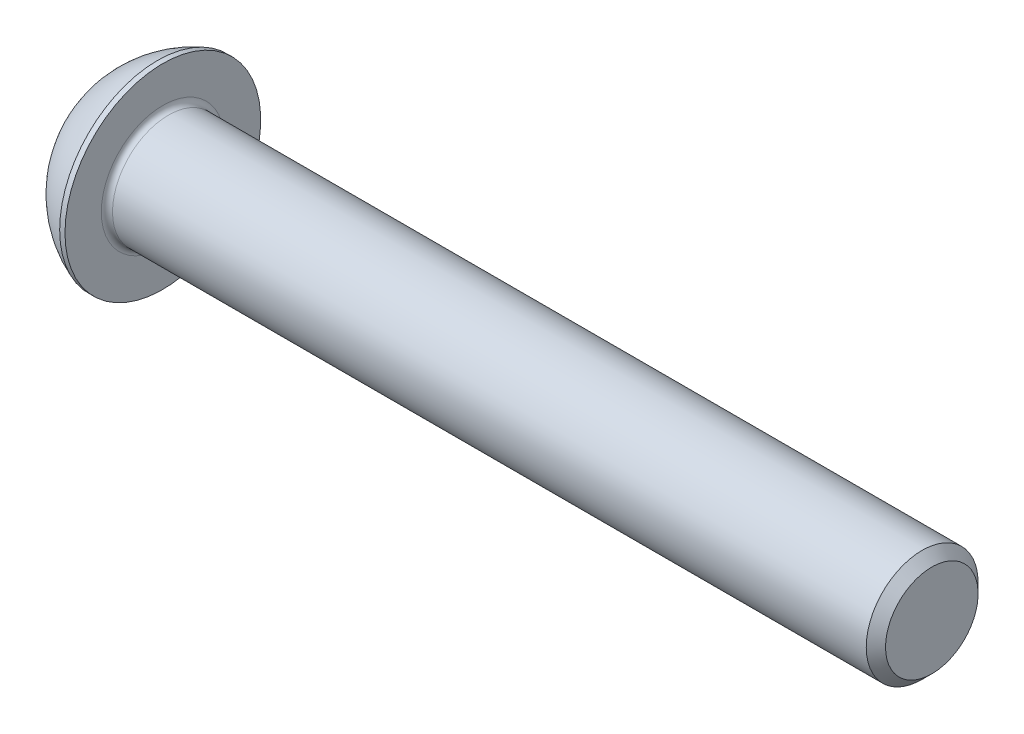
from build123d import *

# Parameters (mm, degrees)
FILLET1_R   = 0.4
HEX_2_DEPTH = 2.6


with BuildPart() as part:
    # BodySke → BaseBody (revolve)
    with BuildSketch(Plane.XY, mode=Mode.PRIVATE) as basebody_sk:
        with BuildLine():
            Line((59.4, 0), (59.4, 3.3095))
            Line((59.4, 3.3095), (58.7095, 4))
            Line((58.7095, 4), (4.4, 4))
            Line((4.4, 4), (4.4, 7))
            Line((4.4, 7), (4.02, 7))
            ThreePointArc((4.02, 7), (1.686451133, 5.621618984), (0, 3.5))
            Line((0, 3.5), (0, 0))
            Line((0, 0), (59.4, 0))
        make_face()
    revolve(basebody_sk.sketch.rotate(Axis((0, 0, 0), (1, 0, 0)), 90), axis=Axis((0, 0, 0), (1, 0, 0)))

    # Fillet1
    fillet1_edges = [part.edges().sort_by_distance(p)[0] for p in [
        (4.4, 0, -4),
    ]]
    fillet(fillet1_edges, radius=FILLET1_R)

    # Sketch2 → PreBroach (revolve, cut)
    with BuildSketch(Plane.XY, mode=Mode.PRIVATE) as prebroach_sk:
        Polygon((0, 2.5), (2.6, 2.5), (4.043375673, 0), (0, 0), align=None)
    revolve(prebroach_sk.sketch.rotate(Axis((0, 0, 0), (1, 0, 0)), 90), axis=Axis((0, 0, 0), (1, 0, 0)), mode=Mode.SUBTRACT)

    # Sketch3 → Hex 2 (cut)
    with BuildSketch(Plane(origin=(0, 0, 0), x_dir=(0, 0, -1), z_dir=(1, 0, 0))):
        Polygon((-2.5, -1.443375673), (-2.5, 1.443375673), (0, 2.886751346), (2.5, 1.443375673), (2.5, -1.443375673), (0, -2.886751346), align=None)
    extrude(amount=HEX_2_DEPTH, mode=Mode.SUBTRACT)


solid = part.part
